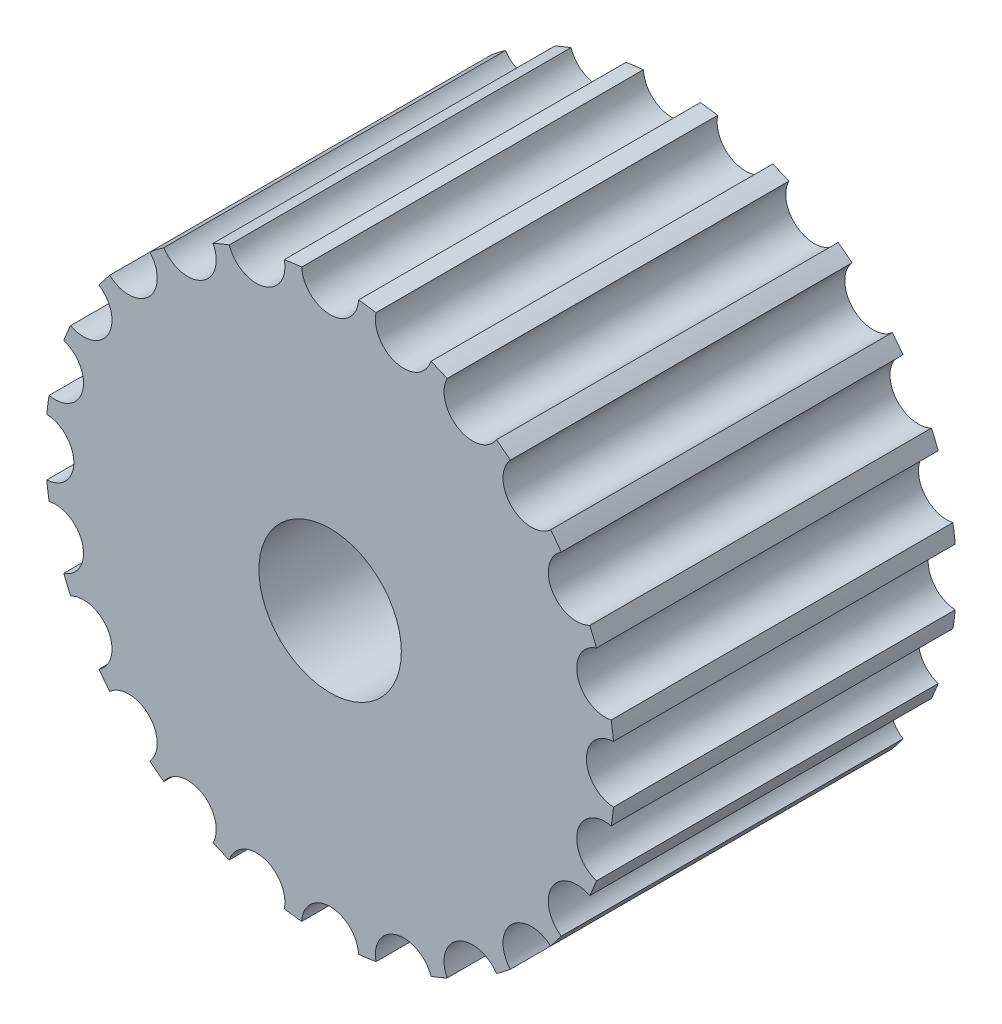
from build123d import *

# Parameters (mm, degrees)
SKETCH1_R               = 10
BOSS_EXTRUDE1_DEPTH     = 12
CUT_EXTRUDE1_DEPTH      = 19.547236991
CUT_EXTRUDE1_DEPTH_BACK = 19.547236991
SKETCH2_R               = 1
SKETCH3_R               = 2.5
CUT_EXTRUDE2_DEPTH      = 19.493377193


with BuildPart() as part:
    # Sketch1 → Boss-Extrude1 (new body)
    with BuildSketch(Plane.XY):
        Circle(SKETCH1_R)
    extrude(amount=BOSS_EXTRUDE1_DEPTH)

    # Sketch2 → Cut-Extrude1 (cut, two sides: drawn at the far end of the back side and taken through both)
    with BuildSketch(Plane.XY.offset(12).offset(-CUT_EXTRUDE1_DEPTH_BACK)):
        with Locations((0, 10)):
            Circle(SKETCH2_R)
        with Locations((2.588190451, 9.659258263)):
            Circle(SKETCH2_R)
        with Locations((5, 8.660254038)):
            Circle(SKETCH2_R)
        with Locations((7.071067812, 7.071067812)):
            Circle(SKETCH2_R)
        with Locations((8.660254038, 5)):
            Circle(SKETCH2_R)
        with Locations((9.659258263, 2.588190451)):
            Circle(SKETCH2_R)
        with Locations((10, 0)):
            Circle(SKETCH2_R)
        with Locations((9.659258263, -2.588190451)):
            Circle(SKETCH2_R)
        with Locations((8.660254038, -5)):
            Circle(SKETCH2_R)
        with Locations((7.071067812, -7.071067812)):
            Circle(SKETCH2_R)
        with Locations((5, -8.660254038)):
            Circle(SKETCH2_R)
        with Locations((2.588190451, -9.659258263)):
            Circle(SKETCH2_R)
        with Locations((0, -10)):
            Circle(SKETCH2_R)
        with Locations((-2.588190451, -9.659258263)):
            Circle(SKETCH2_R)
        with Locations((-5, -8.660254038)):
            Circle(SKETCH2_R)
        with Locations((-7.071067812, -7.071067812)):
            Circle(SKETCH2_R)
        with Locations((-8.660254038, -5)):
            Circle(SKETCH2_R)
        with Locations((-9.659258263, -2.588190451)):
            Circle(SKETCH2_R)
        with Locations((-10, 0)):
            Circle(SKETCH2_R)
        with Locations((-9.659258263, 2.588190451)):
            Circle(SKETCH2_R)
        with Locations((-8.660254038, 5)):
            Circle(SKETCH2_R)
        with Locations((-7.071067812, 7.071067812)):
            Circle(SKETCH2_R)
        with Locations((-5, 8.660254038)):
            Circle(SKETCH2_R)
        with Locations((-2.588190451, 9.659258263)):
            Circle(SKETCH2_R)
    extrude(amount=CUT_EXTRUDE1_DEPTH + CUT_EXTRUDE1_DEPTH_BACK, mode=Mode.SUBTRACT)

    # Sketch3 → Cut-Extrude2 (cut, through all)
    with BuildSketch(Plane.XY.offset(12)):
        Circle(SKETCH3_R)
    extrude(amount=-CUT_EXTRUDE2_DEPTH, mode=Mode.SUBTRACT)


solid = part.part
